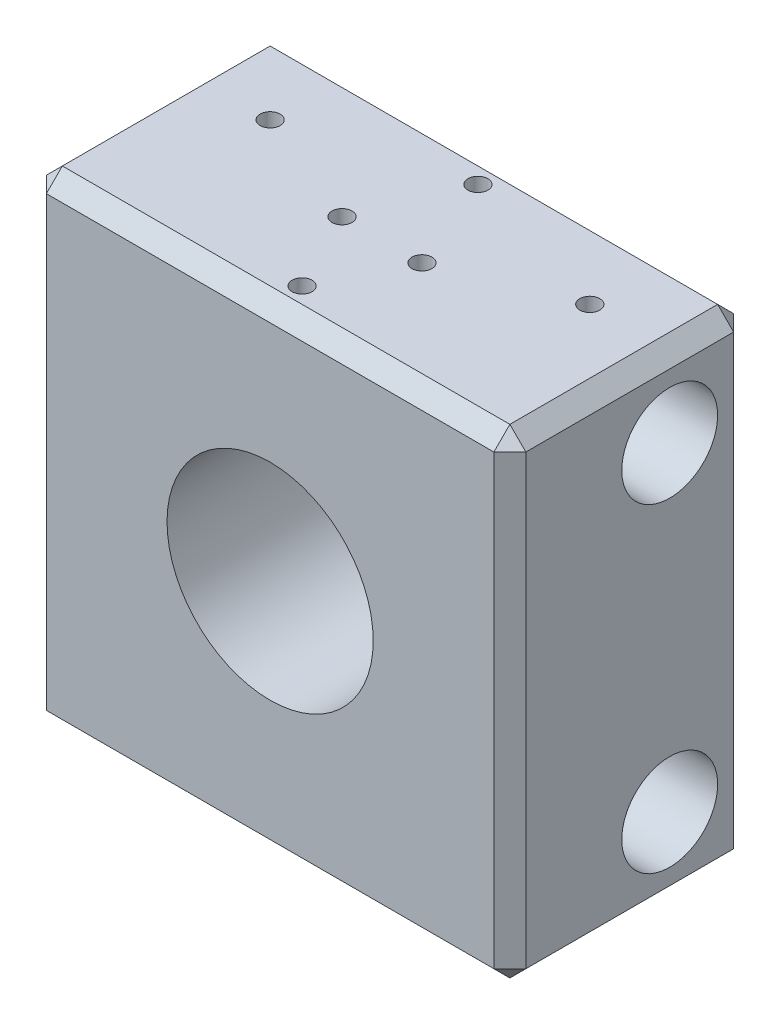
from build123d import *

# Parameters (mm, degrees)
SKETCH1_W           = 60
SKETCH1_H           = 60
SKETCH1_R           = 12.9
BOSS_EXTRUDE1_DEPTH = 30
CUT_EXTRUDE1_DEPTH  = 70
SKETCH3_R           = 1.25
CUT_EXTRUDE2_DEPTH  = 10
SKETCH4_R           = 1.25
CUT_EXTRUDE3_DEPTH  = 30
SKETCH5_R           = 1.25
CUT_EXTRUDE4_DEPTH  = 30
SKETCH6_R           = 1.25
CUT_EXTRUDE5_DEPTH  = 10
CHAMFER2_SIZE       = 2


with BuildPart() as part:
    # Sketch1 → Boss-Extrude1 (new body)
    with BuildSketch(Plane.XY):
        Rectangle(SKETCH1_W, SKETCH1_H)
        Circle(SKETCH1_R, mode=Mode.SUBTRACT)
    extrude(amount=BOSS_EXTRUDE1_DEPTH)

    # Sketch2 → Cut-Extrude1 (cut)
    with BuildSketch(Plane(origin=(30, 0, 0), x_dir=(0, 0, -1), z_dir=(1, 0, 0))):
        with BuildLine():
            ThreePointArc((-4, 20), (-5.757359313, 24.242640687), (-10, 26))
            Line((-10, 26), (-10, 14))
            ThreePointArc((-10, 14), (-5.757359313, 15.757359313), (-4, 20))
        make_face()
        with BuildLine():
            Line((-10, 14), (-10, 26))
            ThreePointArc((-10, 26), (-16, 20), (-10, 14))
        make_face()
        with BuildLine():
            ThreePointArc((-4, -20), (-5.757359313, -15.757359313), (-10, -14))
            Line((-10, -14), (-10, -26))
            ThreePointArc((-10, -26), (-5.757359313, -24.242640687), (-4, -20))
        make_face()
        with BuildLine():
            Line((-10, -26), (-10, -14))
            ThreePointArc((-10, -14), (-16, -20), (-10, -26))
        make_face()
    extrude(amount=-CUT_EXTRUDE1_DEPTH, mode=Mode.SUBTRACT)

    # Sketch3 → Cut-Extrude2 (cut)
    with BuildSketch(Plane(origin=(0, 30, 0), x_dir=(1, 0, 0), z_dir=(0, 1, 0))):
        with Locations(Location((-20, -10, 0), (0, 0, 270))):
            Circle(SKETCH3_R)
        with Locations(Location((20, -10, 0), (0, 0, 270))):
            Circle(SKETCH3_R)
    extrude(amount=-CUT_EXTRUDE2_DEPTH, mode=Mode.SUBTRACT)

    # Sketch4 → Cut-Extrude3 (cut)
    with BuildSketch(Plane(origin=(0, 30, 0), x_dir=(1, 0, 0), z_dir=(0, 1, 0))):
        with Locations(Location((-5, -16, 0), (0, 0, 270))):
            Circle(SKETCH4_R)
        with Locations(Location((5, -16, 0), (0, 0, 270))):
            Circle(SKETCH4_R)
    extrude(amount=-CUT_EXTRUDE3_DEPTH, mode=Mode.SUBTRACT)

    # Sketch5 → Cut-Extrude4 (cut)
    with BuildSketch(Plane(origin=(0, 30, 0), x_dir=(1, 0, 0), z_dir=(0, 1, 0))):
        with Locations(Location((0, -4, 0), (0, 0, 270))):
            Circle(SKETCH5_R)
        with Locations(Location((0, -26, 0), (0, 0, 270))):
            Circle(SKETCH5_R)
    extrude(amount=-CUT_EXTRUDE4_DEPTH, mode=Mode.SUBTRACT)

    # Sketch6 → Cut-Extrude5 (cut)
    with BuildSketch(Plane(origin=(0, -30, 0), x_dir=(-1, 0, 0), z_dir=(0, -1, 0))):
        with Locations(Location((0, -10, 0), (0, 0, 90))):
            Circle(SKETCH6_R)
    extrude(amount=-CUT_EXTRUDE5_DEPTH, mode=Mode.SUBTRACT)

    # Chamfer2
    chamfer2_edges = [part.edges().sort_by_distance(p)[0] for p in [
        (-30, 0, 30),
        (0, -30, 30),
        (30, 0, 30),
        (0, -30, 0),
        (-30, 0, 0),
        (0, 30, 0),
        (30, 0, 0),
        (0, 30, 30),
        (30, -30, 15),
        (-30, -30, 15),
        (-30, 30, 15),
        (30, 30, 15),
    ]]
    chamfer(chamfer2_edges, length=CHAMFER2_SIZE)


solid = part.part
